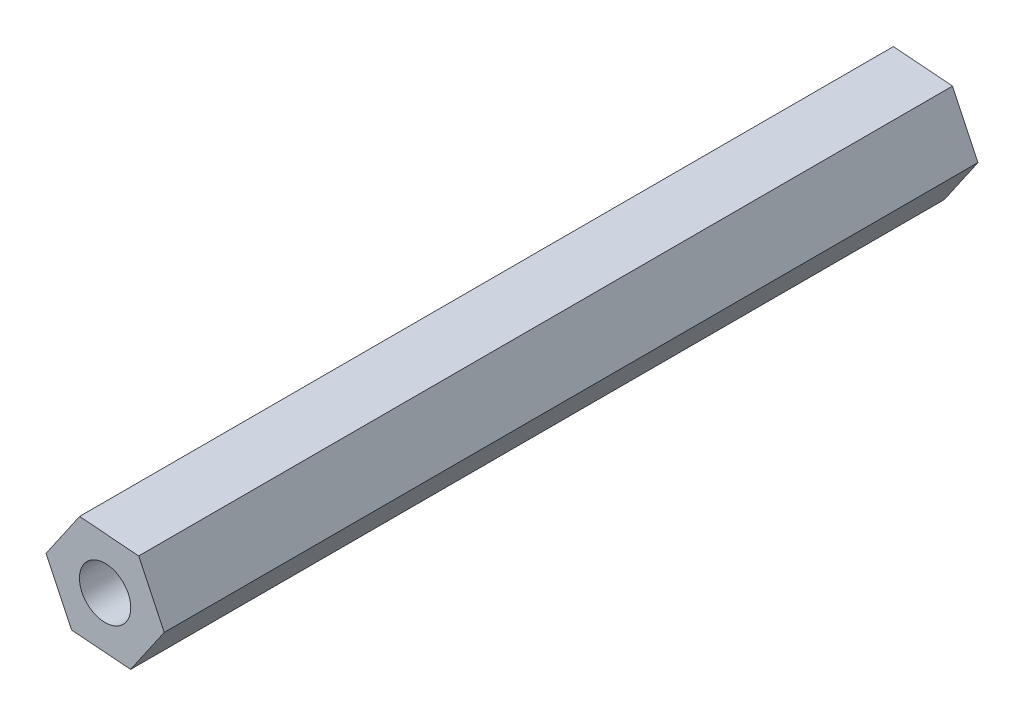
from build123d import *

# Parameters (mm, degrees)
ESQUISSE1_R        = 2.05
BOSS_EXTRU_1_DEPTH = 65


with BuildPart() as part:
    # Esquisse1 → Boss.-Extru.1 (new body)
    with BuildSketch(Plane.XY):
        Polygon((-2.036535943, 4.27385712), (-4.71953681, 0.373236698), (-2.683000867, -3.900620423), (2.036535943, -4.27385712), (4.71953681, -0.373236698), (2.683000867, 3.900620423), align=None)
        Circle(ESQUISSE1_R, mode=Mode.SUBTRACT)
    extrude(amount=BOSS_EXTRU_1_DEPTH)


solid = part.part
